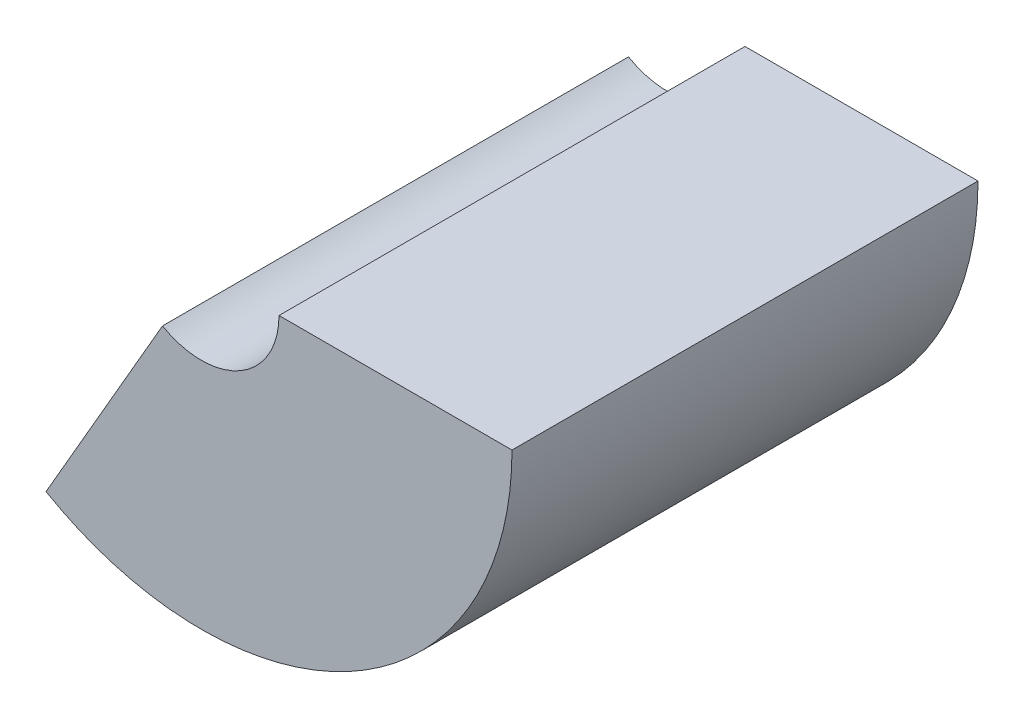
from build123d import *

# Parameters (mm, degrees)
SKETCH1_W      = 15
SKETCH1_H      = 30
REVOLVE1_ANGLE = 120


with BuildPart() as part:
    # Sketch1 → Revolve1 (revolve)
    with BuildSketch(Plane(origin=(0, 0, 0), x_dir=(1, 0, 0), z_dir=(0, 1, 0))):
        with Locations((12.5, 15)):
            Rectangle(SKETCH1_W, SKETCH1_H)
    revolve(axis=Axis((0, 0, 0), (0, 0, -1)), revolution_arc=REVOLVE1_ANGLE)


solid = part.part
